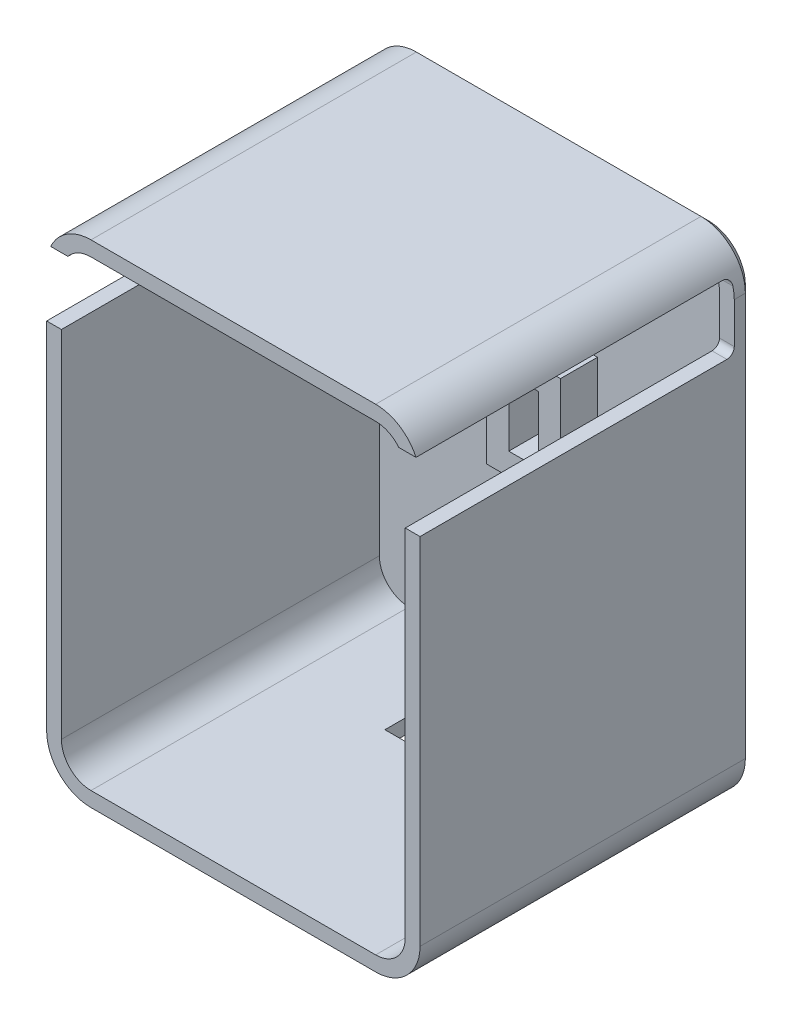
from build123d import *

# Parameters (mm, degrees)
BOSS_EXTRU_1_DEPTH      = 45
ENL_V_MAT_EXTRU_1_DEPTH = 43
ENL_V_MAT_EXTRU_2_DEPTH = 95.855152733
CHANFREIN1_SIZE         = 1
ESQUISSE6_W             = 10
ESQUISSE6_H             = 15
ESQUISSE6_W_2           = 4
ESQUISSE6_H_2           = 9
BOSS_EXTRU_2_DEPTH      = 5
ESQUISSE8_W             = 11
ESQUISSE8_H             = 8
ENL_V_MAT_EXTRU_5_DEPTH = 10


with BuildPart() as part:
    # Esquisse1 → Boss.-Extru.1 (new body)
    with BuildSketch(Plane.XY):
        with BuildLine():
            Line((6, 0), (44.5, 0))
            ThreePointArc((44.5, 0), (48.742640687, 1.757359313), (50.5, 6))
            Line((50.5, 6), (50.5, 60.5))
            ThreePointArc((50.5, 60.5), (48.742640687, 64.742640687), (44.5, 66.5))
            Line((44.5, 66.5), (6, 66.5))
            ThreePointArc((6, 66.5), (1.757359313, 64.742640687), (0, 60.5))
            Line((0, 60.5), (0, 6))
            ThreePointArc((0, 6), (1.757359313, 1.757359313), (6, 0))
        make_face()
    extrude(amount=BOSS_EXTRU_1_DEPTH)

    # Esquisse3 → Enlèv. mat.-Extru.1 (cut)
    with BuildSketch(Plane.XY.offset(45)):
        with BuildLine():
            Line((2, 60.5), (2, 6))
            ThreePointArc((2, 6), (3.171572875, 3.171572875), (6, 2))
            Line((6, 2), (44.5, 2))
            ThreePointArc((44.5, 2), (47.328427125, 3.171572875), (48.5, 6))
            Line((48.5, 6), (48.5, 60.5))
            ThreePointArc((48.5, 60.5), (47.328427125, 63.328427125), (44.5, 64.5))
            Line((44.5, 64.5), (6, 64.5))
            ThreePointArc((6, 64.5), (3.171572875, 63.328427125), (2, 60.5))
        make_face()
    extrude(amount=-ENL_V_MAT_EXTRU_1_DEPTH, mode=Mode.SUBTRACT)

    # Esquisse4 → Enlèv. mat.-Extru.2 (cut, through all)
    with BuildSketch(Plane(origin=(50.5, 0, 0), x_dir=(0, 0, -1), z_dir=(1, 0, 0))):
        with BuildLine():
            Line((-57.973811458, 63), (-3.5, 63))
            ThreePointArc((-3.5, 63), (-2.792893219, 62.707106781), (-2.5, 62))
            Line((-2.5, 62), (-2.5, 55))
            ThreePointArc((-2.5, 55), (-2.792893219, 54.292893219), (-3.5, 54))
            Line((-3.5, 54), (-57.973811458, 54))
            Line((-57.973811458, 54), (-57.973811458, 63))
        make_face()
    extrude(amount=-ENL_V_MAT_EXTRU_2_DEPTH, mode=Mode.SUBTRACT)

    # Chanfrein1
    chanfrein1_edges = [part.edges().sort_by_distance(p)[0] for p in [
        (50.5, 33.25, 0),
        (48.742640687, 1.757359313, 0),
        (25.25, 0, 0),
        (1.757359313, 1.757359313, 0),
        (0, 33.25, 0),
        (1.757359313, 64.742640687, 0),
        (25.25, 66.5, 0),
        (48.742640687, 64.742640687, 0),
    ]]
    chamfer(chanfrein1_edges, length=CHANFREIN1_SIZE)

    # Esquisse6 → Boss.-Extru.2 (add)
    with BuildSketch(Plane.XY.offset(2)):
        with Locations((26.5, 36.5)):
            Rectangle(ESQUISSE6_W, ESQUISSE6_H)
        with Locations((26.5, 36.5)):
            Rectangle(ESQUISSE6_W_2, ESQUISSE6_H_2, mode=Mode.SUBTRACT)
    extrude(amount=BOSS_EXTRU_2_DEPTH)

    # Esquisse8 → Enlèv. mat.-Extru.5 (cut)
    with BuildSketch(Plane.XZ):
        with Locations((24.25, 14)):
            Rectangle(ESQUISSE8_W, ESQUISSE8_H)
    extrude(amount=-ENL_V_MAT_EXTRU_5_DEPTH, mode=Mode.SUBTRACT)


solid = part.part
